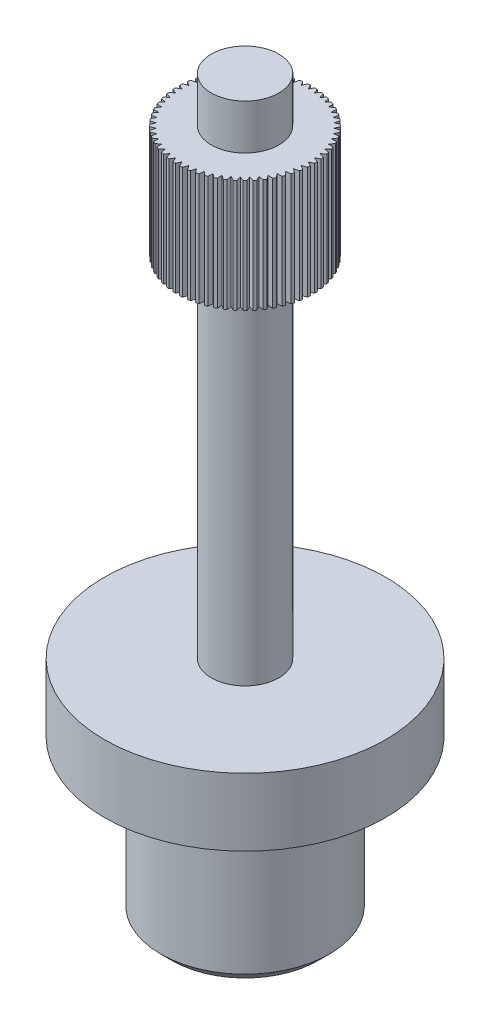
from build123d import *

# Parameters (mm, degrees)
SKETCH_1_R               = 7.5
EXTRUDE_1_DEPTH          = 14
SKETCH_2_R               = 12.5
EXTRUDE_2_DEPTH          = 6
CHAMFER_1_SIZE           = 1
SKETCH_5_R               = 3
EXTRUDE_3_DEPTH          = 45
EXTRUDE_START            = 31
SKETCH_6_R               = 6
EXTRUDE_4_DEPTH          = 10
CUT_EXTRUDE_START        = -10
CUT_EXTRUDE_2_DEPTH      = 10
PATTERN_CIRCULAR_2_COUNT = 60


with BuildPart() as part:
    # 草图1 → 凸台-拉伸1 (new body)
    with BuildSketch(Plane(origin=(0, 0, 0), x_dir=(1, 0, 0), z_dir=(0, 1, 0))):
        with Locations(Location((0, 0, 0), (0, 0, 270))):
            Circle(SKETCH_1_R)
    extrude(amount=EXTRUDE_1_DEPTH)

    # 草图2 → 凸台-拉伸2 (add)
    with BuildSketch(Plane(origin=(0, 14, 0), x_dir=(1, 0, 0), z_dir=(0, 1, 0))):
        with Locations(Location((0, 0, 0), (0, 0, 270))):
            Circle(SKETCH_2_R)
    extrude(amount=EXTRUDE_2_DEPTH)

    # 倒角1
    chamfer_1_edges = [part.edges().sort_by_distance(p)[0] for p in [
        (0, 0, -7.5),
    ]]
    chamfer(chamfer_1_edges, length=CHAMFER_1_SIZE)

    # 草图5 → 凸台-拉伸3 (add)
    with BuildSketch(Plane(origin=(0, 20, 0), x_dir=(1, 0, 0), z_dir=(0, 1, 0))):
        with Locations(Location((0, 0, 0), (0, 0, 90))):
            Circle(SKETCH_5_R)
    extrude(amount=EXTRUDE_3_DEPTH)

    # 草图6 → 凸台-拉伸4 (add)
    with BuildSketch(Plane(origin=(0, 20, 0), x_dir=(1, 0, 0), z_dir=(0, 1, 0)).offset(EXTRUDE_START)):
        with Locations(Location((0, 0, 0), (0, 0, 270))):
            Circle(SKETCH_6_R)
    extrude(amount=EXTRUDE_4_DEPTH)

    # 草图7 → 切除-拉伸2 (cut)
    with BuildSketch(Plane(origin=(0, 61, 0), x_dir=(1, 0, 0), z_dir=(0, 1, 0)).offset(CUT_EXTRUDE_START)):
        with BuildLine():
            Line((0, 5.6), (-0.192715644, 5.996904258))
            ThreePointArc((-0.192715644, 5.996904258), (0, 6), (0.192715644, 5.996904258))
            Line((0.192715644, 5.996904258), (0, 5.6))
        make_face()
    cut_extrude_2 = extrude(amount=CUT_EXTRUDE_2_DEPTH, mode=Mode.SUBTRACT)

    # 阵列(圆周)2: 切除-拉伸2 ×60 about axis
    pattern_circular_2_axis = Axis((0, 0, 0), (0, 1, 0))
    for i in range(1, PATTERN_CIRCULAR_2_COUNT):
        add(cut_extrude_2.rotate(pattern_circular_2_axis, i * 360 / PATTERN_CIRCULAR_2_COUNT), mode=Mode.SUBTRACT)


solid = part.part
